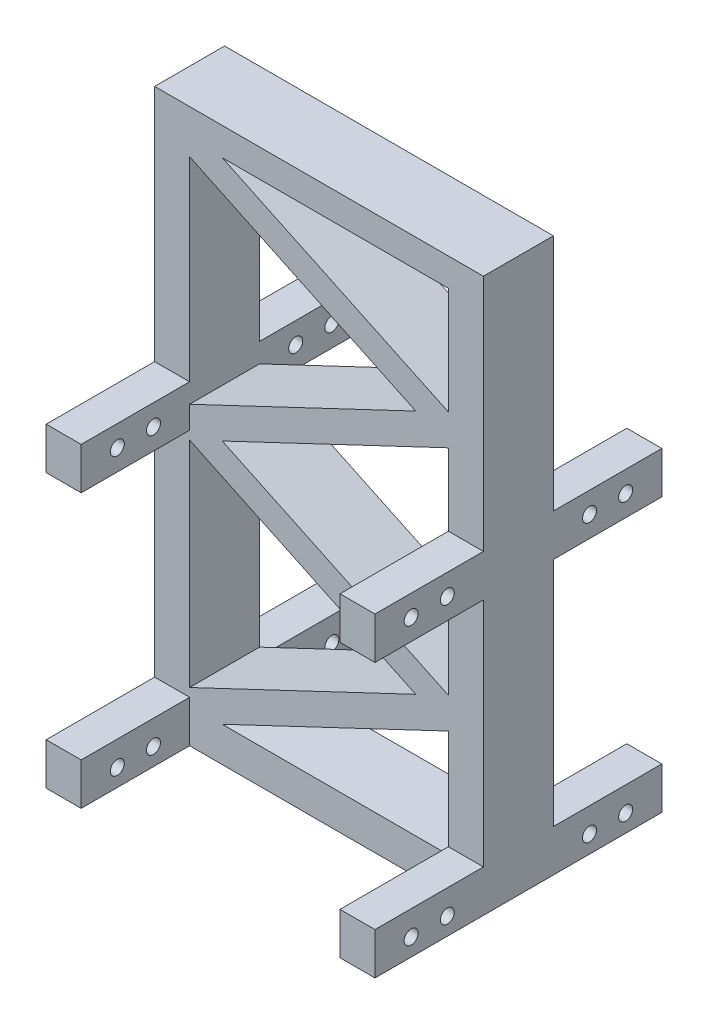
from build123d import *

# Parameters (mm, degrees)
SKETCH_1_W      = 47
SKETCH_1_H      = 79.13
SKETCH_1_W_2    = 37
SKETCH_1_H_2    = 70.13
EXTRUDE_2_DEPTH = 10
SKETCH_2_W      = 15.5
SKETCH_2_H      = 6
SKETCH_2_R      = 1
EXTRUDE_3_DEPTH = 5
EXTRUDE_START   = -42
SKETCH_2_2_W    = 15.5
SKETCH_2_2_H    = 6
SKETCH_2_2_R    = 1
EXTRUDE_4_DEPTH = 5


with BuildPart() as part:
    # 스케치1 → 보스-돌출2 (new body)
    # profile 1 of 8: a face of its own
    with BuildSketch(Plane.XY):
        with Locations((3.5, -0.384376544)):
            Rectangle(SKETCH_1_W, SKETCH_1_H)
        with Locations((3.5, 0.115623456)):
            Rectangle(SKETCH_1_W_2, SKETCH_1_H_2, mode=Mode.SUBTRACT)
    # profile 2 of 8: a face of its own
    with BuildSketch(Plane.XY):
        Polygon((-10.329391215, 35.180623456), (-15, 35.180623456), (-15, 32.967449172), (17.329391215, 17.648123456), (22, 19.861297741), align=None)
    # profile 3 of 8: a face of its own
    with BuildSketch(Plane.XY):
        Polygon((22, 15.434949172), (22, 19.861297741), (17.329391215, 17.648123456), align=None)
    # profile 4 of 8: a face of its own
    with BuildSketch(Plane.XY):
        Polygon((17.329391215, 17.648123456), (-15, 2.328797741), (-10.329391215, 0.115623456), (22, 15.434949172), align=None)
    # profile 5 of 8: a face of its own
    with BuildSketch(Plane.XY):
        Polygon((-10.329391215, 0.115623456), (-15, 2.328797741), (-15, -2.097550828), align=None)
    # profile 6 of 8: a face of its own
    with BuildSketch(Plane.XY):
        Polygon((-10.329391215, 0.115623456), (-15, -2.097550828), (17.329391215, -17.416876544), (22, -15.203702259), align=None)
    # profile 7 of 8: a face of its own
    with BuildSketch(Plane.XY):
        Polygon((22, -19.630050828), (22, -15.203702259), (17.329391215, -17.416876544), align=None)
    # profile 8 of 8: a face of its own
    with BuildSketch(Plane.XY):
        Polygon((17.329391215, -17.416876544), (-15, -32.736202259), (-15, -34.949376544), (-10.329391215, -34.949376544), (22, -19.630050828), align=None)
    extrude(amount=EXTRUDE_2_DEPTH)

    # 스케치2 → 보스-돌출3 (add)
    # profile 1 of 4: a face of its own
    with BuildSketch(Plane(origin=(27, 0, 0), x_dir=(0, 0, -1), z_dir=(1, 0, 0))):
        with Locations((-17.75, -36.949376544)):
            Rectangle(SKETCH_2_W, SKETCH_2_H)
        with Locations(Location((-20.333333333, -37.449376544, 0), (0, 0, 90))):
            Circle(SKETCH_2_R, mode=Mode.SUBTRACT)
        with Locations(Location((-15.166666667, -37.449376544, 0), (0, 0, 90))):
            Circle(SKETCH_2_R, mode=Mode.SUBTRACT)
    # profile 2 of 4: a face of its own
    with BuildSketch(Plane(origin=(27, 0, 0), x_dir=(0, 0, -1), z_dir=(1, 0, 0))):
        with Locations((7.75, -36.949376544)):
            Rectangle(SKETCH_2_W, SKETCH_2_H)
        with Locations(Location((5.166666667, -37.449376544, 0), (0, 0, 90))):
            Circle(SKETCH_2_R, mode=Mode.SUBTRACT)
        with Locations(Location((10.333333333, -37.449376544, 0), (0, 0, 90))):
            Circle(SKETCH_2_R, mode=Mode.SUBTRACT)
    # profile 3 of 4: a face of its own
    with BuildSketch(Plane(origin=(27, 0, 0), x_dir=(0, 0, -1), z_dir=(1, 0, 0))):
        with Locations((-17.75, 2.110623456)):
            Rectangle(SKETCH_2_W, SKETCH_2_H)
        with Locations(Location((-20.333333333, 2.110623456, 0), (0, 0, 90))):
            Circle(SKETCH_2_R, mode=Mode.SUBTRACT)
        with Locations(Location((-15.166666667, 2.110623456, 0), (0, 0, 90))):
            Circle(SKETCH_2_R, mode=Mode.SUBTRACT)
    # profile 4 of 4: a face of its own
    with BuildSketch(Plane(origin=(27, 0, 0), x_dir=(0, 0, -1), z_dir=(1, 0, 0))):
        with Locations((7.75, 2.110623456)):
            Rectangle(SKETCH_2_W, SKETCH_2_H)
        with Locations(Location((5.166666667, 2.110623456, 0), (0, 0, 90))):
            Circle(SKETCH_2_R, mode=Mode.SUBTRACT)
        with Locations(Location((10.333333333, 2.110623456, 0), (0, 0, 90))):
            Circle(SKETCH_2_R, mode=Mode.SUBTRACT)
    extrude(amount=-EXTRUDE_3_DEPTH)

    # 스케치2<2> → 보스-돌출4 (add)
    # profile 1 of 4: a face of its own
    with BuildSketch(Plane(origin=(27, 0, 0), x_dir=(0, 0, -1), z_dir=(1, 0, 0)).offset(EXTRUDE_START)):
        with Locations((-17.75, -36.949376544)):
            Rectangle(SKETCH_2_2_W, SKETCH_2_2_H)
        with Locations(Location((-20.333333333, -37.449376544, 0), (0, 0, 90))):
            Circle(SKETCH_2_2_R, mode=Mode.SUBTRACT)
        with Locations(Location((-15.166666667, -37.449376544, 0), (0, 0, 90))):
            Circle(SKETCH_2_2_R, mode=Mode.SUBTRACT)
    # profile 2 of 4: a face of its own
    with BuildSketch(Plane(origin=(27, 0, 0), x_dir=(0, 0, -1), z_dir=(1, 0, 0)).offset(EXTRUDE_START)):
        with Locations((7.75, -36.949376544)):
            Rectangle(SKETCH_2_2_W, SKETCH_2_2_H)
        with Locations(Location((5.166666667, -37.449376544, 0), (0, 0, 90))):
            Circle(SKETCH_2_2_R, mode=Mode.SUBTRACT)
        with Locations(Location((10.333333333, -37.449376544, 0), (0, 0, 90))):
            Circle(SKETCH_2_2_R, mode=Mode.SUBTRACT)
    # profile 3 of 4: a face of its own
    with BuildSketch(Plane(origin=(27, 0, 0), x_dir=(0, 0, -1), z_dir=(1, 0, 0)).offset(EXTRUDE_START)):
        with Locations((-17.75, 2.110623456)):
            Rectangle(SKETCH_2_2_W, SKETCH_2_2_H)
        with Locations(Location((-20.333333333, 2.110623456, 0), (0, 0, 90))):
            Circle(SKETCH_2_2_R, mode=Mode.SUBTRACT)
        with Locations(Location((-15.166666667, 2.110623456, 0), (0, 0, 90))):
            Circle(SKETCH_2_2_R, mode=Mode.SUBTRACT)
    # profile 4 of 4: a face of its own
    with BuildSketch(Plane(origin=(27, 0, 0), x_dir=(0, 0, -1), z_dir=(1, 0, 0)).offset(EXTRUDE_START)):
        with Locations((7.75, 2.110623456)):
            Rectangle(SKETCH_2_2_W, SKETCH_2_2_H)
        with Locations(Location((5.166666667, 2.110623456, 0), (0, 0, 90))):
            Circle(SKETCH_2_2_R, mode=Mode.SUBTRACT)
        with Locations(Location((10.333333333, 2.110623456, 0), (0, 0, 90))):
            Circle(SKETCH_2_2_R, mode=Mode.SUBTRACT)
    extrude(amount=-EXTRUDE_4_DEPTH)


solid = part.part
